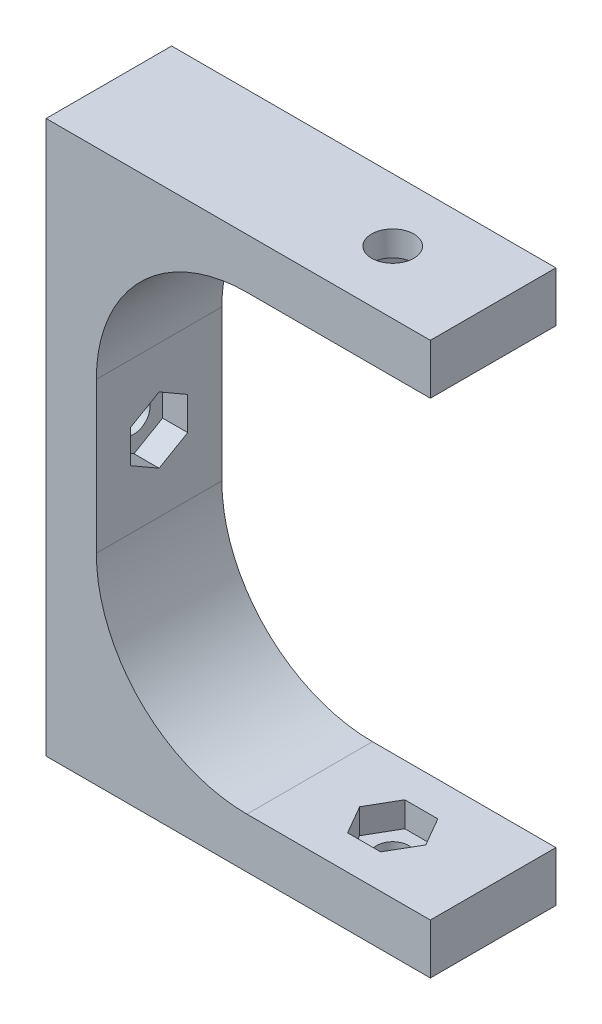
from build123d import *

# Parameters (mm, degrees)
BOSS_EXTRUDE1_DEPTH = 12.5
FILLET1_R           = 15
SKETCH2_R           = 2.1
CUT_EXTRUDE1_DEPTH  = 5
CUT_EXTRUDE2_DEPTH  = 2.5
SKETCH4_R           = 1.6
CUT_EXTRUDE3_DEPTH  = 5
CUT_EXTRUDE4_DEPTH  = 2.5
SKETCH6_R           = 1.6
CUT_EXTRUDE5_DEPTH  = 49.75282328
CUT_EXTRUDE6_DEPTH  = 2.5


with BuildPart() as part:
    # Sketch1 → Boss-Extrude1 (new body)
    with BuildSketch(Plane.XY):
        Polygon((38.266666667, 27.5), (38.266666667, 22.5), (5, 22.5), (5, -22.5), (38.266666667, -22.5), (38.266666667, -27.5), (0, -27.5), (0, 27.5), align=None)
    extrude(amount=BOSS_EXTRUDE1_DEPTH)

    # Fillet1
    fillet1_edges = [part.edges().sort_by_distance(p)[0] for p in [
        (5, 22.5, 6.25),
        (5, -22.5, 6.25),
    ]]
    fillet(fillet1_edges, radius=FILLET1_R)

    # Sketch2 → Cut-Extrude1 (cut)
    with BuildSketch(Plane(origin=(0, 27.5, 0), x_dir=(1, 0, 0), z_dir=(0, 1, 0))):
        with Locations(Location((28.266666667, -6.25, 0), (0, 0, 270))):
            Circle(SKETCH2_R)
    extrude(amount=-CUT_EXTRUDE1_DEPTH, mode=Mode.SUBTRACT)

    # Sketch3 → Cut-Extrude2 (cut)
    with BuildSketch(Plane.XZ.offset(-22.5)):
        Polygon((30.345127636, 9.85), (26.188205698, 9.85), (24.109744729, 6.25), (26.188205698, 2.65), (30.345127636, 2.65), (32.423588605, 6.25), align=None)
    extrude(amount=-CUT_EXTRUDE2_DEPTH, mode=Mode.SUBTRACT)

    # Sketch4 → Cut-Extrude3 (cut)
    with BuildSketch(Plane(origin=(0, -22.5, 0), x_dir=(1, 0, 0), z_dir=(0, 1, 0))):
        with Locations(Location((28.266666667, -6.25, 0), (0, 0, 180))):
            Circle(SKETCH4_R)
    extrude(amount=-CUT_EXTRUDE3_DEPTH, mode=Mode.SUBTRACT)

    # Sketch5 → Cut-Extrude4 (cut)
    with BuildSketch(Plane(origin=(0, -22.5, 0), x_dir=(1, 0, 0), z_dir=(0, 1, 0))):
        Polygon((29.912114934, -3.4), (26.621218399, -3.4), (24.975770132, -6.25), (26.621218399, -9.1), (29.912114934, -9.1), (31.557563201, -6.25), align=None)
    extrude(amount=-CUT_EXTRUDE4_DEPTH, mode=Mode.SUBTRACT)

    # Sketch6 → Cut-Extrude5 (cut, through all)
    with BuildSketch(Plane(origin=(38.266666667, 0, 0), x_dir=(0, 0, -1), z_dir=(1, 0, 0))):
        with Locations(Location((-6.25, 0, 0), (0, 0, 90))):
            Circle(SKETCH6_R)
    extrude(amount=-CUT_EXTRUDE5_DEPTH, mode=Mode.SUBTRACT)

    # Sketch7 → Cut-Extrude6 (cut)
    with BuildSketch(Plane(origin=(5, 0, 0), x_dir=(0, 0, -1), z_dir=(1, 0, 0))):
        Polygon((-3.4, -1.645448267), (-3.4, 1.645448267), (-6.25, 3.290896534), (-9.1, 1.645448267), (-9.1, -1.645448267), (-6.25, -3.290896534), align=None)
    extrude(amount=-CUT_EXTRUDE6_DEPTH, mode=Mode.SUBTRACT)


solid = part.part
